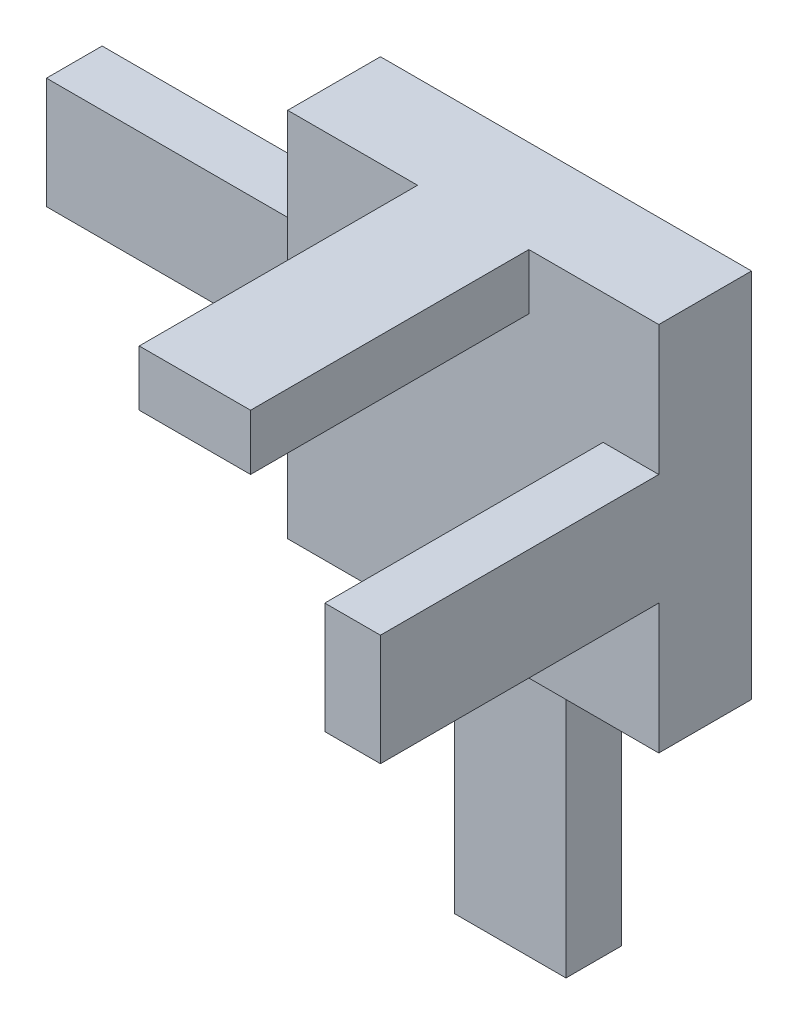
from build123d import *

# Parameters (mm, degrees)
SKETCH_1_W      = 20
SKETCH_1_H      = 20
EXTRUDE_1_DEPTH = 5
SKETCH_2_W      = 6
SKETCH_2_H      = 3
SKETCH_2_W_2    = 3
SKETCH_2_H_2    = 6
EXTRUDE_2_DEPTH = 15
SKETCH_3_W      = 6
SKETCH_3_H      = 3
EXTRUDE_3_DEPTH = 15
SKETCH_4_W      = 3
SKETCH_4_H      = 6
EXTRUDE_4_DEPTH = 15


with BuildPart() as part:
    # Эскиз1 → Бобышка-Вытянуть1 (new body)
    with BuildSketch(Plane.XY):
        with Locations((10, 10)):
            Rectangle(SKETCH_1_W, SKETCH_1_H)
    extrude(amount=EXTRUDE_1_DEPTH)

    # Эскиз2 → Бобышка-Вытянуть2 (add)
    with BuildSketch(Plane.XY.offset(5)):
        with Locations((10, 18.5)):
            Rectangle(SKETCH_2_W, SKETCH_2_H)
        with Locations((18.5, 10)):
            Rectangle(SKETCH_2_W_2, SKETCH_2_H_2)
    extrude(amount=EXTRUDE_2_DEPTH)

    # Эскиз3 → Бобышка-Вытянуть3 (add)
    with BuildSketch(Plane.XZ):
        with Locations((10, 1.5)):
            Rectangle(SKETCH_3_W, SKETCH_3_H)
    extrude(amount=EXTRUDE_3_DEPTH)

    # Эскиз4 → Бобышка-Вытянуть4 (add)
    with BuildSketch(Plane.ZY):
        with Locations((1.5, 10)):
            Rectangle(SKETCH_4_W, SKETCH_4_H)
    extrude(amount=EXTRUDE_4_DEPTH)


solid = part.part
